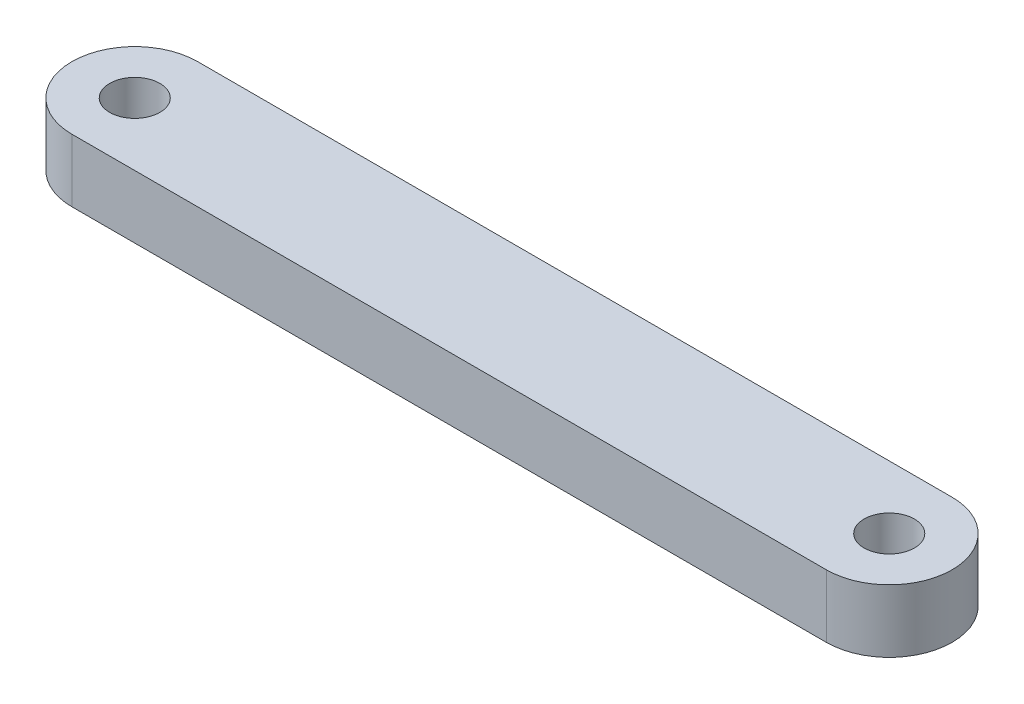
from build123d import *

# Parameters (mm, degrees)
CROQUIS1_R              = 2
SALIENTE_EXTRUIR1_DEPTH = 5


with BuildPart() as part:
    # Croquis1 → Saliente-Extruir1 (new body)
    with BuildSketch(Plane(origin=(0, 0, 0), x_dir=(1, 0, 0), z_dir=(0, 1, 0))):
        with BuildLine():
            Line((0, 5), (60, 5))
            ThreePointArc((60, 5), (65, 0), (60, -5))
            Line((60, -5), (0, -5))
            ThreePointArc((0, -5), (-5, 0), (0, 5))
        make_face()
        with Locations(Location((0, 0, 0), (0, 0, 270))):
            Circle(CROQUIS1_R, mode=Mode.SUBTRACT)
        with Locations(Location((60, 0, 0), (0, 0, 270))):
            Circle(CROQUIS1_R, mode=Mode.SUBTRACT)
    extrude(amount=SALIENTE_EXTRUIR1_DEPTH)


solid = part.part
